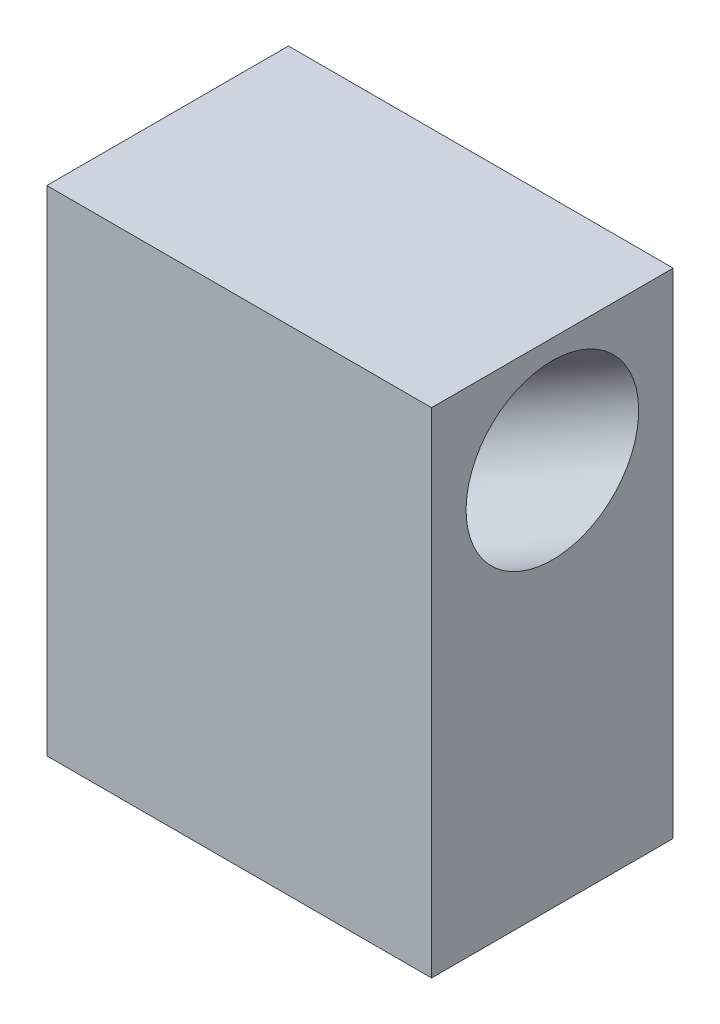
from build123d import *

# Parameters (mm, degrees)
SKETCH1_W           = 28.309650982
SKETCH1_H           = 36.344172283
BOSS_EXTRUDE1_DEPTH = 17.78
SKETCH2_R           = 6.35
CUT_EXTRUDE2_DEPTH  = 37.746201309


with BuildPart() as part:
    # Sketch1 → Boss-Extrude1 (new body)
    with BuildSketch(Plane.XY):
        with Locations((14.154825491, 19.909123788)):
            Rectangle(SKETCH1_W, SKETCH1_H)
    extrude(amount=BOSS_EXTRUDE1_DEPTH)

    # Sketch2 → Cut-Extrude2 (cut, along a direction that is not the sketch's normal)
    with BuildSketch(Plane(origin=(28.309650982, 0, 0), x_dir=(0, 0, -1), z_dir=(1, 0, 0))):
        with Locations((-8.89, 30.280911184)):
            Circle(SKETCH2_R)
    extrude(amount=-CUT_EXTRUDE2_DEPTH, dir=(0.866025403784438, 0.5000000000000011, 0), mode=Mode.SUBTRACT)


solid = part.part
